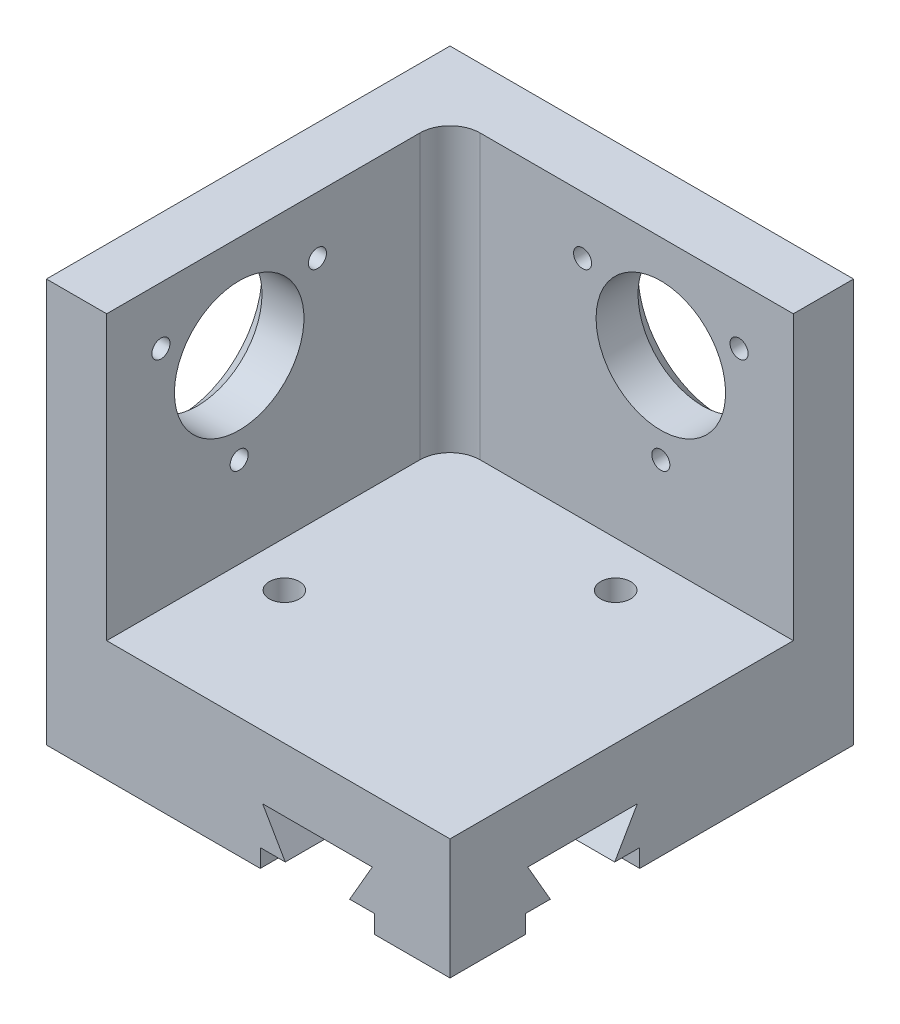
from build123d import *

# Parameters (mm, degrees)
SKETCH1_W                    = 67
SKETCH1_H                    = 67
BOSS_EXTRUDE1_DEPTH          = 67
SKETCH2_W                    = 57
SKETCH2_H                    = 57
CUT_EXTRUDE1_DEPTH           = 47
CUT_EXTRUDE2_REACH           = 102.5
SKETCH3_R                    = 10.75
CUT_EXTRUDE3_REACH           = 102.5
SKETCH4_R                    = 10.75
F_5_0_5_DIAMETER_HOLE1_D     = 5
F_5_0_5_DIAMETER_HOLE1_DEPTH = 5
F_5_0_5_DIAMETER_HOLE1_TIP   = 1.502151548
FILLET1_R                    = 5
CHAMFER1_SIZE                = 3.04
CUT_EXTRUDE4_REACH           = 102.5
CUT_EXTRUDE5_DEPTH           = 101.5
SKETCH9_R                    = 1.5
CUT_EXTRUDE6_DEPTH           = 10
SKETCH10_R                   = 1.5
CUT_EXTRUDE7_DEPTH           = 10


with BuildPart() as part:
    # Sketch1 → Boss-Extrude1 (new body)
    with BuildSketch(Plane(origin=(0, 0, 0), x_dir=(1, 0, 0), z_dir=(0, 1, 0))):
        Rectangle(SKETCH1_W, SKETCH1_H)
    extrude(amount=BOSS_EXTRUDE1_DEPTH)

    # Sketch2 → Cut-Extrude1 (cut)
    with BuildSketch(Plane(origin=(0, 67, 0), x_dir=(1, 0, 0), z_dir=(0, 1, 0))):
        with Locations((5, -5)):
            Rectangle(SKETCH2_W, SKETCH2_H)
    extrude(amount=-CUT_EXTRUDE1_DEPTH, mode=Mode.SUBTRACT)

    # Sketch3 → Cut-Extrude2 (cut, up to next)
    with BuildSketch(Plane.ZY.offset(33.5), mode=Mode.PRIVATE) as cut_extrude2_sk1:
        with Locations((11.5, 50)):
            Circle(SKETCH3_R)
    cut_extrude2_tool1 = extrude(cut_extrude2_sk1.sketch, amount=-CUT_EXTRUDE2_REACH, mode=Mode.PRIVATE) & part.part
    add(cut_extrude2_tool1.solids().sort_by_distance((-33.5, 50, 11.5))[0], mode=Mode.SUBTRACT)

    # Sketch4 → Cut-Extrude3 (cut, up to next)
    with BuildSketch(Plane(origin=(0, 0, -33.5), x_dir=(-1, 0, 0), z_dir=(0, 0, -1)), mode=Mode.PRIVATE) as cut_extrude3_sk1:
        with Locations((-11.5, 50)):
            Circle(SKETCH4_R)
    cut_extrude3_tool1 = extrude(cut_extrude3_sk1.sketch, amount=-CUT_EXTRUDE3_REACH, mode=Mode.PRIVATE) & part.part
    add(cut_extrude3_tool1.solids().sort_by_distance((11.5, 50, -33.5))[0], mode=Mode.SUBTRACT)

    # Ø5.0 (5) Diameter Hole1
    with Locations(Plane(origin=(0, 20, 0), x_dir=(-1, 0, 0), z_dir=(0, 1, 0))):
        with Locations((16, 11.5), (-11.5, -16)):
            Hole(F_5_0_5_DIAMETER_HOLE1_D / 2, depth=F_5_0_5_DIAMETER_HOLE1_DEPTH)
            with Locations((0, 0, -(F_5_0_5_DIAMETER_HOLE1_DEPTH + F_5_0_5_DIAMETER_HOLE1_TIP / 2))):  # 118° drill point
                Cone(0, F_5_0_5_DIAMETER_HOLE1_D / 2, F_5_0_5_DIAMETER_HOLE1_TIP, mode=Mode.SUBTRACT)

    # Fillet1
    fillet1_edges = [part.edges().sort_by_distance(p)[0] for p in [
        (-23.5, 43.5, -23.5),
    ]]
    fillet(fillet1_edges, radius=FILLET1_R)

    # Chamfer1
    chamfer1_edges = [part.edges().sort_by_distance(p)[0] for p in [
        (-33.5, 50, 0.75),
        (22.25, 50, -33.5),
    ]]
    chamfer(chamfer1_edges, length=CHAMFER1_SIZE)

    # Sketch7 → Cut-Extrude4 (cut, up to next)
    with BuildSketch(Plane(origin=(33.5, 0, 0), x_dir=(0, 0, -1), z_dir=(1, 0, 0)), mode=Mode.PRIVATE) as cut_extrude4_sk1:
        Polygon((-2.4, 9.5), (-20.6, 9.5), (-16.84722325, 3), (-21, 3), (-21, 0), (-2, 0), (-2, 3), (-6.15277675, 3), align=None)
    cut_extrude4_tool1 = extrude(cut_extrude4_sk1.sketch, amount=-CUT_EXTRUDE4_REACH, mode=Mode.PRIVATE) & part.part
    add(cut_extrude4_tool1.solids().sort_by_distance((33.5, 4.630961, 11.5))[0], mode=Mode.SUBTRACT)

    # Sketch8 → Cut-Extrude5 (cut, through all)
    with BuildSketch(Plane.XY.offset(33.5)):
        Polygon((2.4, 9.5), (20.6, 9.5), (16.84722325, 3), (21, 3), (21, 0), (2, 0), (2, 3), (6.15277675, 3), align=None)
    extrude(amount=-CUT_EXTRUDE5_DEPTH, mode=Mode.SUBTRACT)

    # Sketch9 → Cut-Extrude6 (cut)
    with BuildSketch(Plane.ZY.offset(33.5)):
        with Locations((-1.490381057, 57.5)):
            Circle(SKETCH9_R)
        with Locations((24.490381057, 57.5)):
            Circle(SKETCH9_R)
        with Locations((11.5, 35)):
            Circle(SKETCH9_R)
    extrude(amount=-CUT_EXTRUDE6_DEPTH, mode=Mode.SUBTRACT)

    # Sketch10 → Cut-Extrude7 (cut)
    with BuildSketch(Plane(origin=(0, 0, -33.5), x_dir=(-1, 0, 0), z_dir=(0, 0, -1))):
        with Locations((1.490381057, 57.5)):
            Circle(SKETCH10_R)
        with Locations((-24.490381057, 57.5)):
            Circle(SKETCH10_R)
        with Locations((-11.5, 35)):
            Circle(SKETCH10_R)
    extrude(amount=-CUT_EXTRUDE7_DEPTH, mode=Mode.SUBTRACT)


solid = part.part
